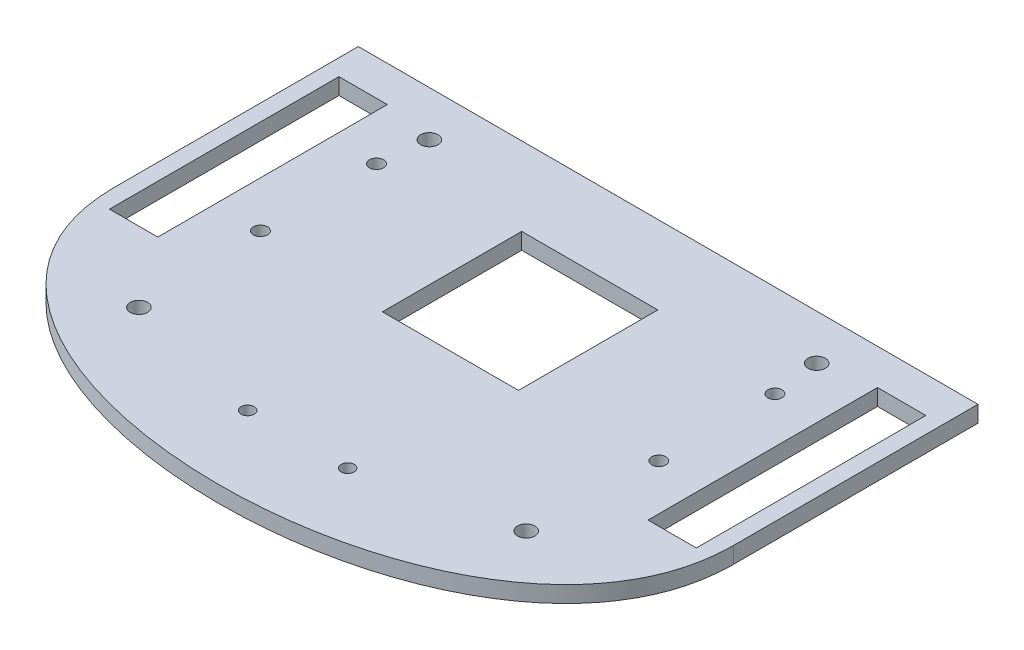
from build123d import *

# Parameters (mm, degrees)
BOSS_EXTRUDE1_DEPTH     = 2.54
CUT_EXTRUDE1_DEPTH      = 60.34583774
CUT_EXTRUDE1_DEPTH_BACK = 60.34583774
SKETCH3_R               = 1.0922
SKETCH3_R_2             = 1.35
SKETCH3_R_3             = 1.016
SKETCH3_W               = 7.493
SKETCH3_H               = 35.56
SKETCH3_W_2             = 21.082
SKETCH3_H_2             = 21.59


with BuildPart() as part:
    # Sketch2 → Boss-Extrude1 (new body)
    with BuildSketch(Plane(origin=(0, 0, 0), x_dir=(1, 0, 0), z_dir=(0, 1, 0))):
        with BuildLine():
            Line((48.006, 34.798), (-48.006, 34.798))
            Line((-48.006, 34.798), (-48.006, -3.048))
            add(Edge.make_bspline(
                [(-48.006, -3.048), (-48.006, -45.381333333), (48.006, -45.381333333), (48.006, -3.048)],
                knots=[0, 0, 0, 0, 1, 1, 1, 1], degree=3))
            Line((48.006, -3.048), (48.006, 34.798))
        make_face()
    extrude(amount=BOSS_EXTRUDE1_DEPTH)

    # Sketch3 → Cut-Extrude1 (cut, two sides: drawn at the far end of the back side and taken through both)
    with BuildSketch(Plane(origin=(0, 2.54, 0), x_dir=(1, 0, 0), z_dir=(0, 1, 0)).offset(-CUT_EXTRUDE1_DEPTH_BACK)):
        with Locations(Location((-30.861, 20.4696, 0), (0, 0, 270))):
            Circle(SKETCH3_R)
        with Locations(Location((-30.861, 2.4864, 0), (0, 0, 270))):
            Circle(SKETCH3_R)
        with Locations(Location((-30, 27.798, 0), (0, 0, 270))):
            Circle(SKETCH3_R_2)
        with Locations(Location((30.861, 2.4864, 0), (0, 0, 90))):
            Circle(SKETCH3_R)
        with Locations(Location((30.861, 20.4696, 0), (0, 0, 90))):
            Circle(SKETCH3_R)
        with Locations(Location((-30, -17.202, 0), (0, 0, 270))):
            Circle(SKETCH3_R_2)
        with Locations(Location((30, -17.202, 0), (0, 0, 90))):
            Circle(SKETCH3_R_2)
        with Locations(Location((30, 27.798, 0), (0, 0, 90))):
            Circle(SKETCH3_R_2)
        with Locations(Location((-7.747, -22.606, 0), (0, 0, 270))):
            Circle(SKETCH3_R_3)
        with Locations(Location((7.747, -22.606, 0), (0, 0, 90))):
            Circle(SKETCH3_R_3)
        with Locations((-41.7195, 11.478)):
            Rectangle(SKETCH3_W, SKETCH3_H)
        with Locations((41.7195, 11.478)):
            Rectangle(SKETCH3_W, SKETCH3_H)
        with Locations((0, 11.859)):
            Rectangle(SKETCH3_W_2, SKETCH3_H_2)
    extrude(amount=CUT_EXTRUDE1_DEPTH + CUT_EXTRUDE1_DEPTH_BACK, mode=Mode.SUBTRACT)


solid = part.part
